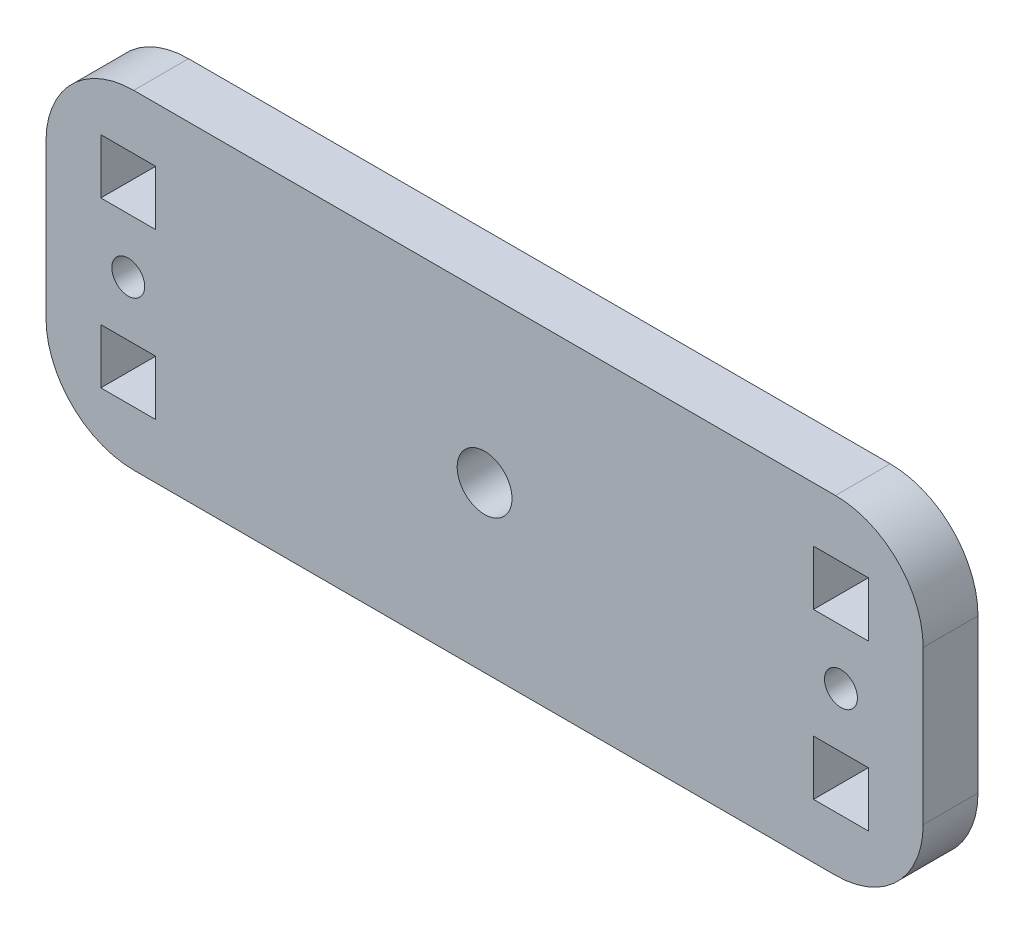
from build123d import *

# Parameters (mm, degrees)
ESQUISSE1_R        = 1.5
ESQUISSE1_R_2      = 2.5
ESQUISSE1_W        = 5
ESQUISSE1_H        = 5
BOSS_EXTRU_1_DEPTH = 5


with BuildPart() as part:
    # Esquisse1 → Boss.-Extru.1 (new body)
    with BuildSketch(Plane.XY):
        with BuildLine():
            Line((8, 0), (72, 0))
            ThreePointArc((72, 0), (77.656854249, 2.343145751), (80, 8))
            Line((80, 8), (80, 22))
            ThreePointArc((80, 22), (77.656854249, 27.656854249), (72, 30))
            Line((72, 30), (8, 30))
            ThreePointArc((8, 30), (2.343145751, 27.656854249), (0, 22))
            Line((0, 22), (0, 8))
            ThreePointArc((0, 8), (2.343145751, 2.343145751), (8, 0))
        make_face()
        with Locations((7.5, 15)):
            Circle(ESQUISSE1_R, mode=Mode.SUBTRACT)
        with Locations((72.5, 15)):
            Circle(ESQUISSE1_R, mode=Mode.SUBTRACT)
        with Locations((40, 15)):
            Circle(ESQUISSE1_R_2, mode=Mode.SUBTRACT)
        with Locations((7.5, 22.5)):
            Rectangle(ESQUISSE1_W, ESQUISSE1_H, mode=Mode.SUBTRACT)
        with Locations((72.5, 22.5)):
            Rectangle(ESQUISSE1_W, ESQUISSE1_H, mode=Mode.SUBTRACT)
        with Locations((72.5, 7.5)):
            Rectangle(ESQUISSE1_W, ESQUISSE1_H, mode=Mode.SUBTRACT)
        with Locations((7.5, 7.5)):
            Rectangle(ESQUISSE1_W, ESQUISSE1_H, mode=Mode.SUBTRACT)
    extrude(amount=BOSS_EXTRU_1_DEPTH)


solid = part.part
